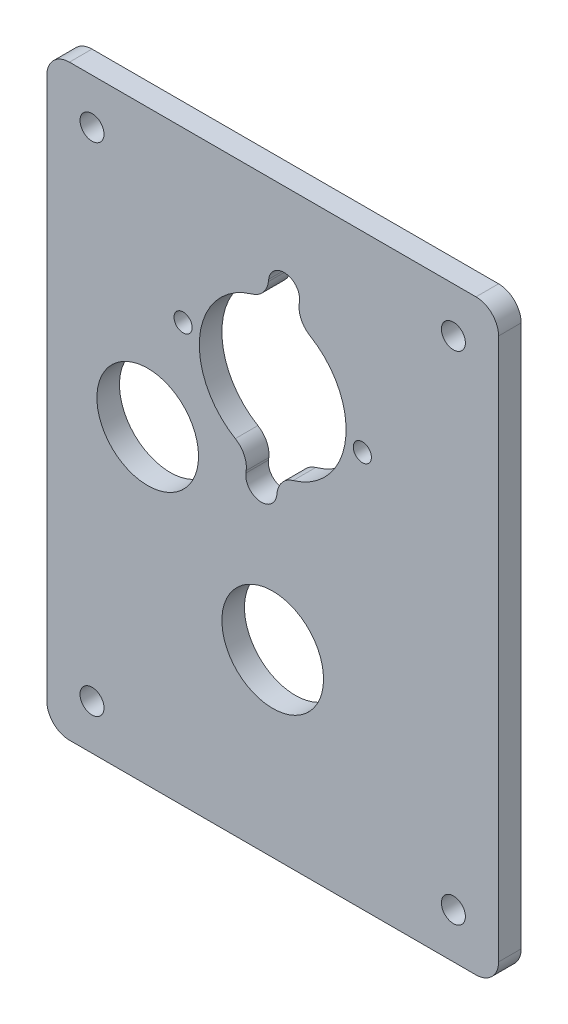
from build123d import *

# Parameters (mm, degrees)
SKETCH1_W           = 127
SKETCH1_H           = 165.1
SKETCH1_R           = 3.3734375
SKETCH1_R_2         = 14.2875
SKETCH1_R_3         = 2.5527
BOSS_EXTRUDE1_DEPTH = 6.35
FILLET1_R           = 6.35


with BuildPart() as part:
    # Sketch1 → Boss-Extrude1 (new body)
    with BuildSketch(Plane.XY):
        Rectangle(SKETCH1_W, SKETCH1_H)
        with Locations((-50.8, 69.85)):
            Circle(SKETCH1_R, mode=Mode.SUBTRACT)
        with Locations((50.8, 69.85)):
            Circle(SKETCH1_R, mode=Mode.SUBTRACT)
        with Locations((50.8, -69.85)):
            Circle(SKETCH1_R, mode=Mode.SUBTRACT)
        with Locations((-50.8, -69.85)):
            Circle(SKETCH1_R, mode=Mode.SUBTRACT)
        with Locations((0, -31.952201006)):
            Circle(SKETCH1_R_2, mode=Mode.SUBTRACT)
        with Locations((-35.1409, 4.732361785)):
            Circle(SKETCH1_R_2, mode=Mode.SUBTRACT)
        with Locations((25.197543761, 28.751609125)):
            Circle(SKETCH1_R_3, mode=Mode.SUBTRACT)
        with Locations((-25.197543761, 35.152792887)):
            Circle(SKETCH1_R_3, mode=Mode.SUBTRACT)
        with BuildLine():
            Line((-7.534569408, 7.305159048), (-7.454878346, 7.932548946))
            ThreePointArc((-7.454878346, 7.932548946), (-8.049848215, 11.522345151), (-10.517966807, 14.196109643))
            ThreePointArc((-10.517966807, 14.196109643), (-20.473004306, 34.552681909), (-5.744824378, 51.773992023))
            ThreePointArc((-5.744824378, 51.773992023), (-2.686624737, 53.7458036), (-1.213076708, 57.072856673))
            Line((-1.213076708, 57.072856673), (-1.133385646, 57.700246571))
            ThreePointArc((-1.133385646, 57.700246571), (3.751093684, 61.483722294), (7.534569408, 56.599242964))
            Line((7.534569408, 56.599242964), (7.454878346, 55.971853066))
            ThreePointArc((7.454878346, 55.971853066), (8.049848215, 52.38205686), (10.517966807, 49.708292369))
            ThreePointArc((10.517966807, 49.708292369), (20.473004306, 29.351720103), (5.744824378, 12.130409989))
            ThreePointArc((5.744824378, 12.130409989), (2.686624737, 10.158598412), (1.213076708, 6.831545339))
            Line((1.213076708, 6.831545339), (1.133385646, 6.204155441))
            ThreePointArc((1.133385646, 6.204155441), (-3.751093684, 2.420679717), (-7.534569408, 7.305159048))
        make_face(mode=Mode.SUBTRACT)
    extrude(amount=BOSS_EXTRUDE1_DEPTH)

    # Fillet1
    fillet1_edges = [part.edges().sort_by_distance(p)[0] for p in [
        (63.5, -82.55, 3.175),
        (-63.5, -82.55, 3.175),
        (-63.5, 82.55, 3.175),
        (63.5, 82.55, 3.175),
    ]]
    fillet(fillet1_edges, radius=FILLET1_R)


solid = part.part
